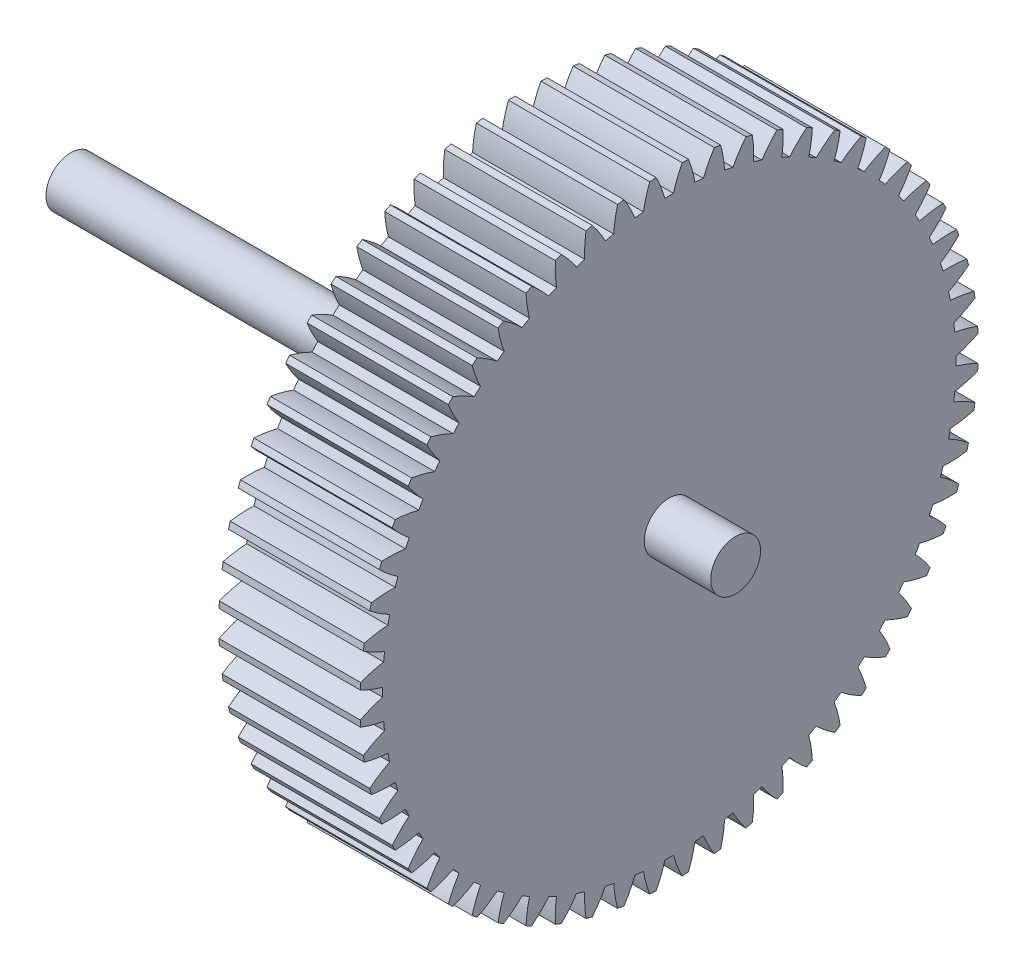
from build123d import *

# Parameters (mm, degrees)
BASPROSKE_W                          = 8.5
BASPROSKE_H                          = 18.6
TOOTHCUT_DEPTH                       = 28.643624943
TEETHCUTS_COUNT                      = 60
TEETHCUTS_ANGLE                      = 354
BORSKE_R                             = 1
BORE_DEPTH                           = 50.0000508
AUFSATZ_LINEAR_AUSTRAGEN1_DEPTH      = 4
AUFSATZ_LINEAR_AUSTRAGEN1_DEPTH_BACK = 36
SKIZZE1_R                            = 1.5


with BuildPart() as part:
    # BasProSke → Base-Revolve (revolve)
    with BuildSketch(Plane(origin=(0, 0, 0), x_dir=(1, 0, 0), z_dir=(0, 1, 0)), mode=Mode.PRIVATE) as base_revolve_sk:
        with Locations((4.25, 9.3)):
            Rectangle(BASPROSKE_W, BASPROSKE_H)
    revolve(base_revolve_sk.sketch.rotate(Axis((-10, 0, 0), (1, 0, 0)), 180), axis=Axis((-10, 0, 0), (1, 0, 0)))

    # TooCutSke → ToothCut (cut, through all)
    with BuildSketch(Plane(origin=(0, 0, 0), x_dir=(0, 0, -1), z_dir=(1, 0, 0))):
        with BuildLine():
            ThreePointArc((0.258315292, 17.24706567), (0, 17.249), (-0.258315292, 17.24706567))
            ThreePointArc((-0.258315292, 17.24706567), (-0.491042076, 17.94140175), (-0.793093586, 18.608506864))
            ThreePointArc((-0.793093586, 18.608506864), (0, 18.6254), (0.793093586, 18.608506864))
            ThreePointArc((0.793093586, 18.608506864), (0.491042076, 17.94140175), (0.258315292, 17.24706567))
        make_face()
    toothcut = extrude(amount=TOOTHCUT_DEPTH, mode=Mode.SUBTRACT)

    # TeethCuts: ToothCut ×60 about axis
    teethcuts_axis = Axis((-10, 0, 0), (1, 0, 0))
    for i in range(1, TEETHCUTS_COUNT):
        add(toothcut.rotate(teethcuts_axis, i * TEETHCUTS_ANGLE / (TEETHCUTS_COUNT - 1)), mode=Mode.SUBTRACT)

    # BorSke → Bore (cut, symmetric)
    with BuildSketch(Plane(origin=(0, 0, 0), x_dir=(0, 0, -1), z_dir=(1, 0, 0))):
        with Locations(Location((0, 0, 0), (0, 0, 180))):
            Circle(BORSKE_R)
    extrude(amount=BORE_DEPTH, both=True, mode=Mode.SUBTRACT)

    # Skizze1 → Aufsatz-Linear austragen1 (add, two sides: drawn at the far end of the back side and taken through both)
    with BuildSketch(Plane(origin=(8.5, 0, 0), x_dir=(0, 0, -1), z_dir=(1, 0, 0)).offset(-AUFSATZ_LINEAR_AUSTRAGEN1_DEPTH_BACK)):
        Circle(SKIZZE1_R)
    extrude(amount=AUFSATZ_LINEAR_AUSTRAGEN1_DEPTH + AUFSATZ_LINEAR_AUSTRAGEN1_DEPTH_BACK)


solid = part.part
